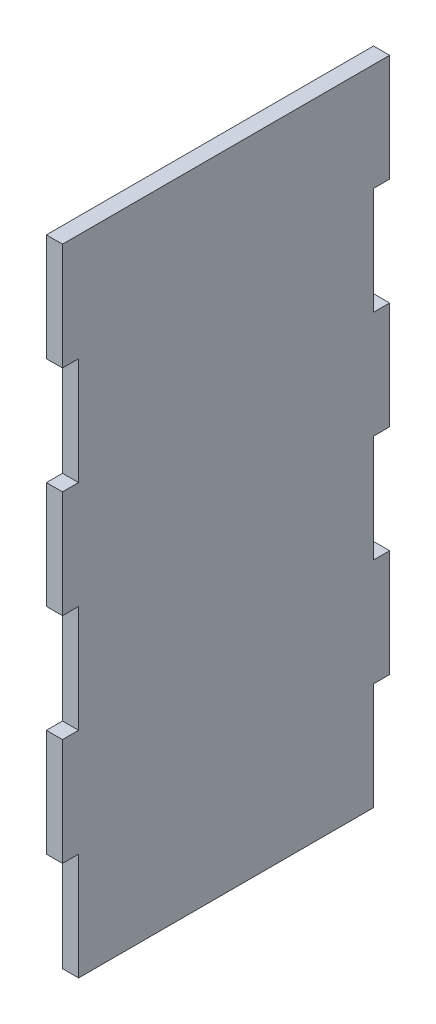
from build123d import *

# Parameters (mm, degrees)
BOSS_EXTRUDE1_DEPTH = 3


with BuildPart() as part:
    # Sketch1 → Boss-Extrude1 (new body)
    with BuildSketch(Plane(origin=(0, 0, 0), x_dir=(0, 0, -1), z_dir=(1, 0, 0))):
        Polygon((-27.5, 0), (27.5, 0), (27.5, 20), (30.5, 20), (30.5, 40), (27.5, 40), (27.5, 60), (30.5, 60), (30.5, 80), (27.5, 80), (27.5, 100), (30.5, 100), (30.5, 120), (-30.5, 120), (-30.5, 100), (-27.5, 100), (-27.5, 80), (-30.5, 80), (-30.5, 60), (-27.5, 60), (-27.5, 40), (-30.5, 40), (-30.5, 20), (-27.5, 20), align=None)
    extrude(amount=BOSS_EXTRUDE1_DEPTH)


solid = part.part
